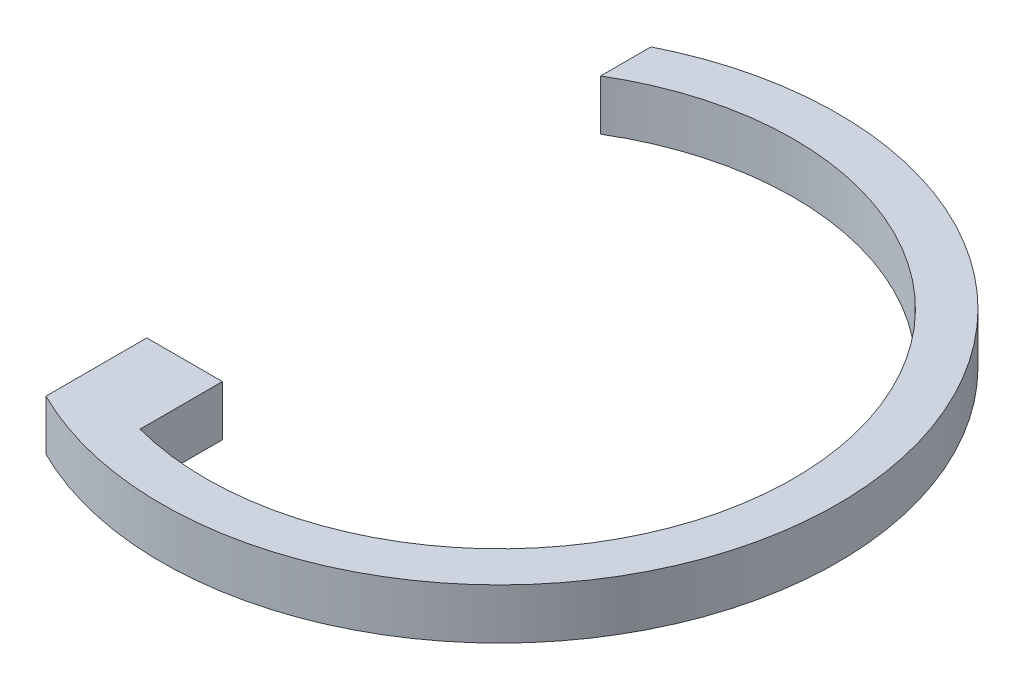
from build123d import *

# Parameters (mm, degrees)
BOSS_EXTRUDE1_DEPTH = 10
SKETCH2_W           = 20
SKETCH2_H           = 10
BOSS_EXTRUDE2_DEPTH = 15


with BuildPart() as part:
    # Sketch1 → Boss-Extrude1 (new body)
    with BuildSketch(Plane(origin=(0, 0, 0), x_dir=(1, 0, 0), z_dir=(0, 1, 0))):
        with BuildLine():
            Line((-20, 50), (-20, 60))
            ThreePointArc((-20, 60), (77.082039325, 0), (-20, -60))
            Line((-20, -60), (-20, -50))
            ThreePointArc((-20, -50), (68.309518948, 0), (-20, 50))
        make_face()
    extrude(amount=-BOSS_EXTRUDE1_DEPTH)

    # Sketch2 → Boss-Extrude2 (add)
    with BuildSketch(Plane.ZY.offset(20)):
        with Locations((50, -5)):
            Rectangle(SKETCH2_W, SKETCH2_H)
    extrude(amount=-BOSS_EXTRUDE2_DEPTH)


solid = part.part
